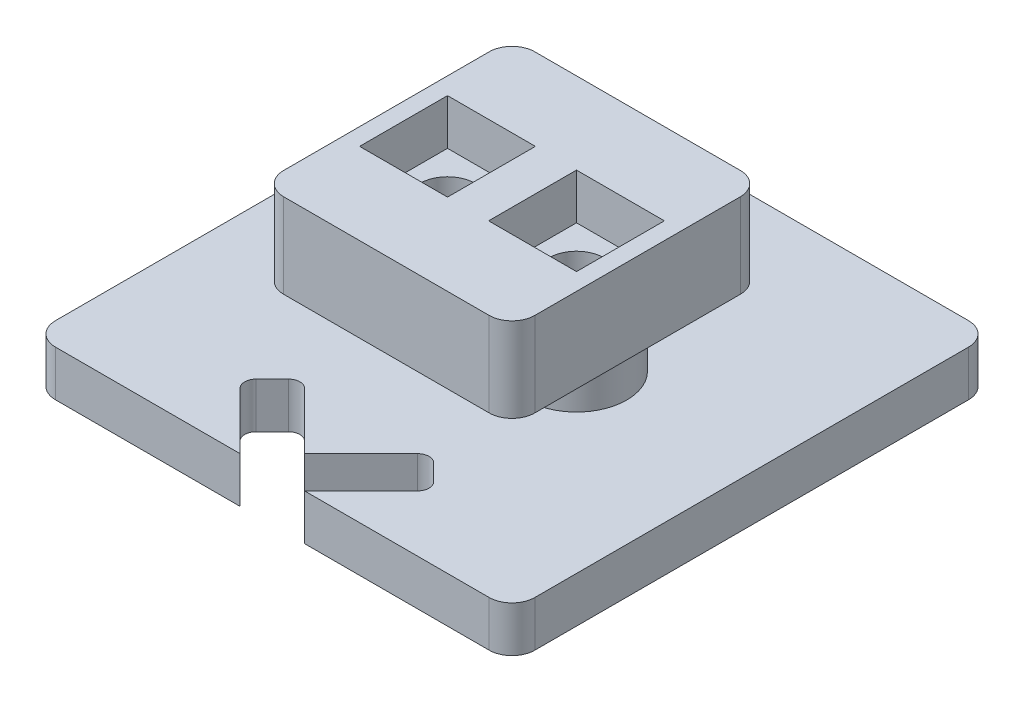
from build123d import *

# Parameters (mm, degrees)
SKETCH1_W           = 11
SKETCH1_H           = 11
BOSS_EXTRUDE1_DEPTH = 3.7
FILLET1_R           = 1
SKETCH2_W           = 3.85
SKETCH2_H           = 3.85
CUT_EXTRUDE1_DEPTH  = 2
SKETCH4_R           = 2.2
BOSS_EXTRUDE2_DEPTH = 4
BOSS_EXTRUDE3_DEPTH = 2
SKETCH3_R           = 1.2
CUT_EXTRUDE2_DEPTH  = 17.726924403
CUT_EXTRUDE3_DEPTH  = 16.90565937


with BuildPart() as part:
    # Sketch1 → Boss-Extrude1 (new body)
    with BuildSketch(Plane(origin=(0, 0, 0), x_dir=(1, 0, 0), z_dir=(0, 1, 0))):
        Rectangle(SKETCH1_W, SKETCH1_H)
    extrude(amount=BOSS_EXTRUDE1_DEPTH)

    # Fillet1
    fillet1_edges = [part.edges().sort_by_distance(p)[0] for p in [
        (5.5, 1.85, 5.5),
        (-5.5, 1.85, 5.5),
        (-5.5, 1.85, -5.5),
        (5.5, 1.85, -5.5),
    ]]
    fillet(fillet1_edges, radius=FILLET1_R)

    # Sketch2 → Cut-Extrude1 (cut)
    with BuildSketch(Plane(origin=(0, 3.7, 0), x_dir=(1, 0, 0), z_dir=(0, 1, 0))):
        with Locations((-2.825, 0)):
            Rectangle(SKETCH2_W, SKETCH2_H)
        with Locations((2.825, 0)):
            Rectangle(SKETCH2_W, SKETCH2_H)
    extrude(amount=-CUT_EXTRUDE1_DEPTH, mode=Mode.SUBTRACT)

    # Sketch4 → Boss-Extrude2 (add)
    with BuildSketch(Plane(origin=(0, 0, 0), x_dir=(-1, 0, 0), z_dir=(0, -1, 0))):
        with Locations(Location((2.825, 0, 0), (0, 0, 90))):
            Circle(SKETCH4_R)
        with Locations(Location((-2.825, 0, 0), (0, 0, 90))):
            Circle(SKETCH4_R)
    extrude(amount=BOSS_EXTRUDE2_DEPTH)

    # Sketch5 → Boss-Extrude3 (add)
    with BuildSketch(Plane(origin=(0, -4, 0), x_dir=(-1, 0, 0), z_dir=(0, -1, 0))):
        with BuildLine():
            Line((9.5, 10.5), (-9.5, 10.5))
            ThreePointArc((-9.5, 10.5), (-10.207106781, 10.207106781), (-10.5, 9.5))
            Line((-10.5, 9.5), (-10.5, -9.5))
            ThreePointArc((-10.5, -9.5), (-10.207106781, -10.207106781), (-9.5, -10.5))
            Line((-9.5, -10.5), (9.5, -10.5))
            ThreePointArc((9.5, -10.5), (10.207106781, -10.207106781), (10.5, -9.5))
            Line((10.5, -9.5), (10.5, 9.5))
            ThreePointArc((10.5, 9.5), (10.207106781, 10.207106781), (9.5, 10.5))
        make_face()
    extrude(amount=-BOSS_EXTRUDE3_DEPTH)

    # Sketch3 → Cut-Extrude2 (cut, through all)
    with BuildSketch(Plane(origin=(0, 3.7, 0), x_dir=(1, 0, 0), z_dir=(0, 1, 0))):
        with Locations(Location((-2.825, 0, 0), (0, 0, 270))):
            Circle(SKETCH3_R)
        with Locations(Location((2.825, 0, 0), (0, 0, 270))):
            Circle(SKETCH3_R)
    extrude(amount=-CUT_EXTRUDE2_DEPTH, mode=Mode.SUBTRACT)

    # Sketch7 → Cut-Extrude3 (cut, through all)
    with BuildSketch(Plane(origin=(0, -2, 0), x_dir=(1, 0, 0), z_dir=(0, 1, 0))):
        with BuildLine():
            Line((0, -9.085786438), (1.414213562, -10.5))
            Line((1.414213562, -10.5), (3.889087297, -8.025126266))
            ThreePointArc((3.889087297, -8.025126266), (4.035533906, -7.671572875), (3.889087297, -7.318019485))
            Line((3.889087297, -7.318019485), (3.181980515, -6.610912703))
            ThreePointArc((3.181980515, -6.610912703), (2.828427125, -6.464466094), (2.474873734, -6.610912703))
            Line((2.474873734, -6.610912703), (0, -9.085786438))
        make_face()
        with BuildLine():
            Line((-3.889087297, -8.025126266), (-1.414213562, -10.5))
            Line((-1.414213562, -10.5), (0, -9.085786438))
            Line((0, -9.085786438), (-2.474873734, -6.610912703))
            ThreePointArc((-2.474873734, -6.610912703), (-2.828427125, -6.464466094), (-3.181980515, -6.610912703))
            Line((-3.181980515, -6.610912703), (-3.889087297, -7.318019485))
            ThreePointArc((-3.889087297, -7.318019485), (-4.035533906, -7.671572875), (-3.889087297, -8.025126266))
        make_face()
        Polygon((-1.414213562, -10.5), (1.414213562, -10.5), (0, -9.085786438), align=None)
    extrude(amount=-CUT_EXTRUDE3_DEPTH, mode=Mode.SUBTRACT)


solid = part.part
